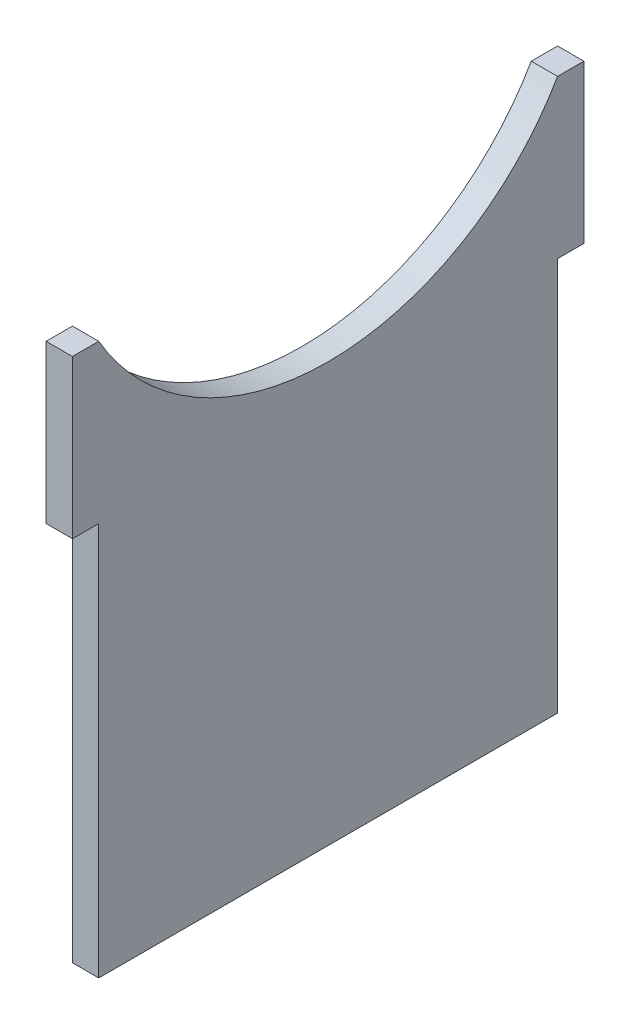
from build123d import *

# Parameters (mm, degrees)
SKETCH1_W           = 1.5875
SKETCH1_H           = 9.525
BOSS_EXTRUDE1_DEPTH = 1.5875


with BuildPart() as part:
    # Sketch1 → Boss-Extrude1 (new body)
    with BuildSketch(Plane(origin=(0, 0, 0), x_dir=(0, 0, -1), z_dir=(1, 0, 0))):
        with BuildLine():
            ThreePointArc((13.843, -7.992259776), (0, -15.984519553), (-13.843, -7.992259776))
            Line((-13.843, -7.992259776), (-13.843, -17.517259776))
            Line((-13.843, -17.517259776), (-13.843, -41.26395491))
            Line((-13.843, -41.26395491), (13.843, -41.26395491))
            Line((13.843, -41.26395491), (13.843, -17.517259776))
            Line((13.843, -17.517259776), (15.4305, -17.517259776))
            Line((15.4305, -17.517259776), (15.4305, -7.992259776))
            Line((15.4305, -7.992259776), (13.843, -7.992259776))
        make_face()
        with Locations((-14.63675, -12.754759776)):
            Rectangle(SKETCH1_W, SKETCH1_H)
    extrude(amount=BOSS_EXTRUDE1_DEPTH)


solid = part.part
